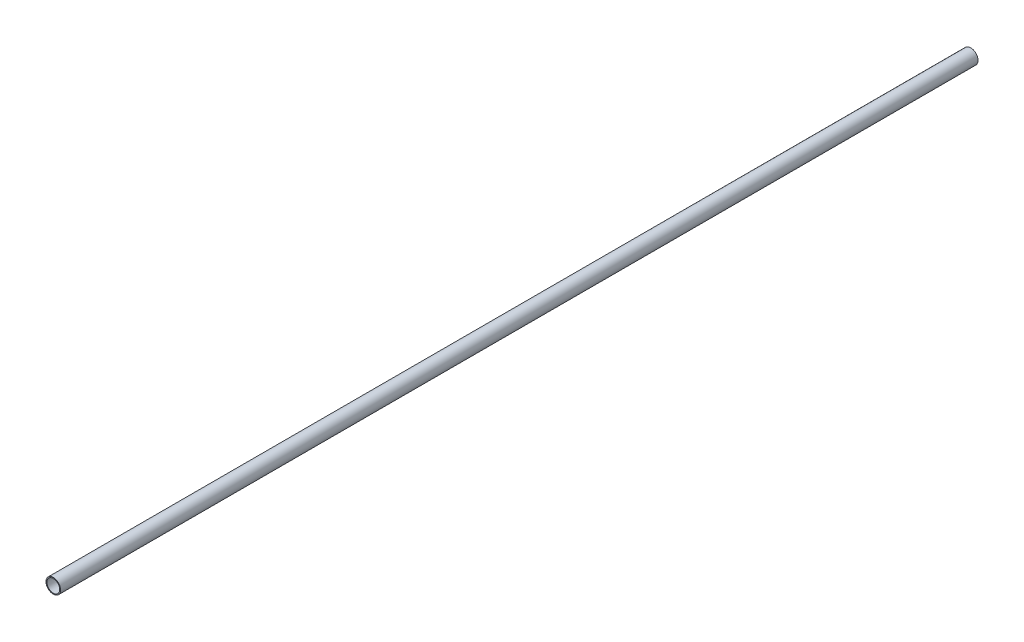
from build123d import *

# Parameters (mm, degrees)
SKETCH1_R           = 7.95
SKETCH1_R_2         = 6.95
BOSS_EXTRUDE1_DEPTH = 1000


with BuildPart() as part:
    # Sketch1 → Boss-Extrude1 (new body)
    with BuildSketch(Plane.XY):
        with Locations((155.331009868, 335.849590782)):
            Circle(SKETCH1_R)
        with Locations((155.331009868, 335.849590782)):
            Circle(SKETCH1_R_2, mode=Mode.SUBTRACT)
    extrude(amount=BOSS_EXTRUDE1_DEPTH)


solid = part.part
